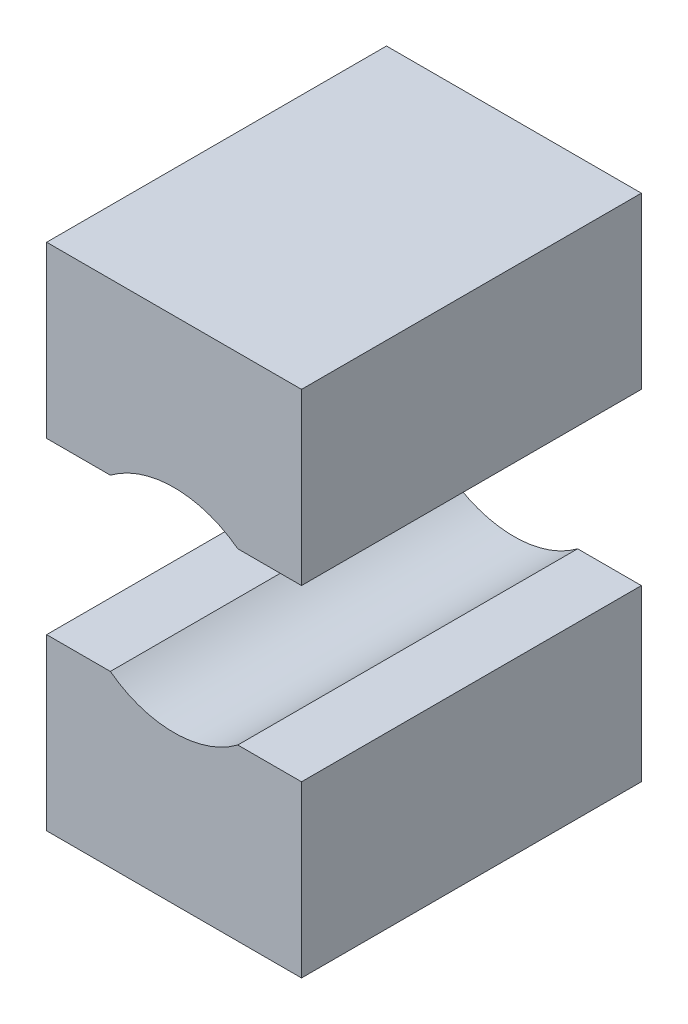
from build123d import *

# Parameters (mm, degrees)
SKIZZE1_W                         = 30
SKIZZE1_H                         = 20
AUFSATZ_LINEAR_AUSTRAGEN1_DEPTH   = 40
AUFSATZ_LINEAR_AUSTRAGEN1_2_DEPTH = 40
SKIZZE2_R                         = 12.5
SCHNITT_LINEAR_AUSTRAGEN1_DEPTH   = 50


with BuildPart() as part:
    # Skizze1 → Aufsatz-Linear austragen1 (new body)
    with BuildSketch(Plane.XY):
        with Locations((0, 20)):
            Rectangle(SKIZZE1_W, SKIZZE1_H)
    extrude(amount=-AUFSATZ_LINEAR_AUSTRAGEN1_DEPTH)


with BuildPart() as body_2:
    # Skizze1 → Aufsatz-Linear austragen1 2 (new body)
    with BuildSketch(Plane.XY):
        with Locations((0, -20)):
            Rectangle(SKIZZE1_W, SKIZZE1_H)
    extrude(amount=-AUFSATZ_LINEAR_AUSTRAGEN1_2_DEPTH)


with BuildPart() as schnitt_linear_austragen1_tool:
    # Skizze2 → Schnitt-Linear austragen1 (new body)
    with BuildSketch(Plane.XY):
        Circle(SKIZZE2_R)
    extrude(amount=-SCHNITT_LINEAR_AUSTRAGEN1_DEPTH)


with BuildPart() as part_1:
    add(part.part)

    # Schnitt-Linear austragen1: cut by schnitt_linear_austragen1_tool
    add(schnitt_linear_austragen1_tool.part, mode=Mode.SUBTRACT)


with BuildPart() as body_2_1:
    add(body_2.part)

    # Schnitt-Linear austragen1: cut by schnitt_linear_austragen1_tool
    add(schnitt_linear_austragen1_tool.part, mode=Mode.SUBTRACT)


solid = Compound([part_1.part, body_2_1.part])
